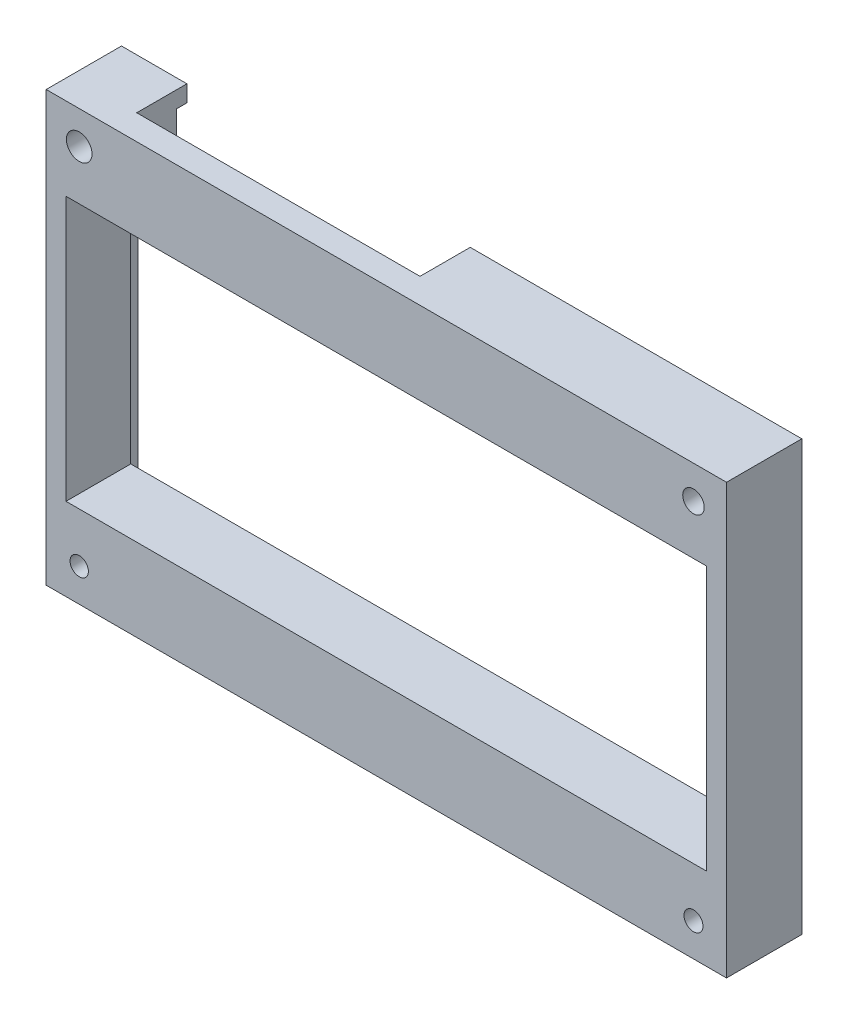
from build123d import *

# Parameters (mm, degrees)
SKETCH2_W               = 103
SKETCH2_H               = 65
BOSS_EXTRUDE1_DEPTH     = 9.8
SKETCH4_W               = 97
SKETCH4_H               = 40
CUT_EXTRUDE1_DEPTH      = 35
SKETCH6_W               = 42.890315644
SKETCH6_H               = 9.943201627
CUT_EXTRUDE3_DEPTH      = 6
SKETCH9_W               = 103
SKETCH9_H               = 65
SKETCH9_W_2             = 98
SKETCH9_H_2             = 60
BOSS_EXTRUDE2_DEPTH     = 1.6
SKETCH10_W              = 42.890315644
SKETCH10_H              = 16.344193147
CUT_EXTRUDE4_DEPTH      = 9.943201627
CUT_EXTRUDE7_DEPTH      = 28
CUT_EXTRUDE7_DEPTH_BACK = 33
SKETCH14_R              = 1.629970135
SKETCH14_R_2            = 1.938580121
SKETCH14_R_3            = 1.388390768
SKETCH14_R_4            = 1.438089521


with BuildPart() as part:
    # Sketch2 → Boss-Extrude1 (new body)
    with BuildSketch(Plane.XY):
        Rectangle(SKETCH2_W, SKETCH2_H)
    extrude(amount=BOSS_EXTRUDE1_DEPTH)

    # Sketch4 → Cut-Extrude1 (cut)
    with BuildSketch(Plane.XY.offset(9.8)):
        Rectangle(SKETCH4_W, SKETCH4_H)
    extrude(amount=-CUT_EXTRUDE1_DEPTH, mode=Mode.SUBTRACT)

    # Sketch6 → Cut-Extrude3 (cut)
    with BuildSketch(Plane(origin=(0, 0, 0), x_dir=(-1, 0, 0), z_dir=(0, 0, -1))):
        with Locations((20.148258429, 27.528399187)):
            Rectangle(SKETCH6_W, SKETCH6_H)
    extrude(amount=-CUT_EXTRUDE3_DEPTH, mode=Mode.SUBTRACT)

    # Sketch9 → Boss-Extrude2 (add)
    with BuildSketch(Plane(origin=(0, 0, 0), x_dir=(-1, 0, 0), z_dir=(0, 0, -1))):
        Rectangle(SKETCH9_W, SKETCH9_H)
        Rectangle(SKETCH9_W_2, SKETCH9_H_2, mode=Mode.SUBTRACT)
    extrude(amount=BOSS_EXTRUDE2_DEPTH)

    # Sketch10 → Cut-Extrude4 (cut)
    with BuildSketch(Plane(origin=(0, 32.5, 0), x_dir=(1, 0, 0), z_dir=(0, 1, 0))):
        with Locations((-20.148258429, 8.172096574)):
            Rectangle(SKETCH10_W, SKETCH10_H)
    extrude(amount=-CUT_EXTRUDE4_DEPTH, mode=Mode.SUBTRACT)

    # Sketch14 → Cut-Extrude7 (cut, two sides: drawn at the far end of the back side and taken through both)
    with BuildSketch(Plane(origin=(0, 0, -1.6), x_dir=(-1, 0, 0), z_dir=(0, 0, -1)).offset(-CUT_EXTRUDE7_DEPTH_BACK)):
        with Locations((-46.5, 27.5)):
            Circle(SKETCH14_R)
        with Locations((46.5, 27.5)):
            Circle(SKETCH14_R_2)
        with Locations((46.5, -27.5)):
            Circle(SKETCH14_R_3)
        with Locations((-46.5, -27.5)):
            Circle(SKETCH14_R_4)
    extrude(amount=CUT_EXTRUDE7_DEPTH + CUT_EXTRUDE7_DEPTH_BACK, mode=Mode.SUBTRACT)


solid = part.part
